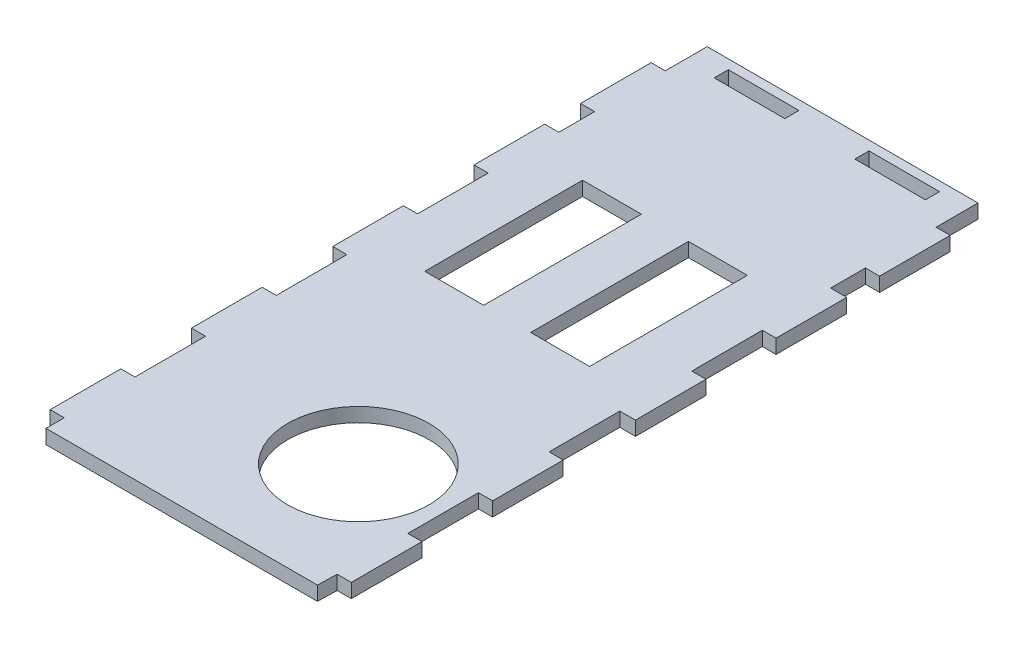
from build123d import *

# Parameters (mm, degrees)
SKETCH_1_R      = 30
SKETCH_1_W      = 25
SKETCH_1_H      = 67
EXTRUDE_1_DEPTH = 6


with BuildPart() as part:
    # Эскиз1 → Бобышка-Вытянуть1 (new body)
    with BuildSketch(Plane(origin=(0, 0, 0), x_dir=(1, 0, 0), z_dir=(0, 1, 0))):
        Polygon((-63.5, -90.219106224), (-63.5, -120.219106224), (-57.5, -120.219106224), (-57.5, -127.987103964), (-44.534331601, -127.987103964), (-14.534331601, -127.987103964), (15.172762814, -127.987103964), (45.172762814, -127.987103964), (57.756160079, -127.987103964), (57.965668399, -119.808299483), (63.965668399, -119.808299483), (63.965668399, -89.808299483), (57.965668399, -89.808299483), (57.965668399, -59.808299483), (63.965668399, -59.808299483), (63.965668399, -29.808299483), (57.965668399, -29.808299483), (57.965668399, 0.191700517), (64.611703668, 0.204499173), (64.557084704, 30.204449452), (58.557094649, 30.193525659), (58.502475685, 60.193475939), (64.331284091, 60.191395834), (64.331888746, 90.191395828), (57.5, 90.191533526), (57.5, 104.982806986), (63.5, 104.982806986), (63.5, 134.982806986), (57.5, 134.982806986), (57.5, 152.780893776), (-14.534331601, 152.780893776), (-57.5, 152.780893776), (-57.5, 134.982806986), (-63.5, 134.982806986), (-63.5, 104.982806986), (-57.5, 104.982806986), (-57.5, 89.780893776), (-63.5, 89.780893776), (-63.5, 59.780893776), (-63.034331601, 59.780893776), (-57.5, 59.780893776), (-57.5, 42.012896036), (-57.5, 29.780893776), (-63.5, 29.780893776), (-63.5, -0.219106224), (-63.034331601, -0.219106224), (-57.5, -0.219106224), (-57.5, -17.987103964), (-57.5, -30.219106224), (-63.5, -30.219106224), (-63.5, -60.219106224), (-63.034331601, -60.219106224), (-57.5, -60.219106224), (-57.5, -77.987103964), (-57.5, -90.219106224), align=None)
        with Locations(Location((21.965668399, -74.808299483, 0), (0, 0, 270))):
            Circle(SKETCH_1_R, mode=Mode.SUBTRACT)
        with Locations((-22.350212696, 43.691700517)):
            Rectangle(SKETCH_1_W, SKETCH_1_H, mode=Mode.SUBTRACT)
        Polygon((-14.534331601, 142.780893776), (-44.534331601, 142.780893776), (-44.534331601, 146.780893776), (-44.534331601, 148.780893776), (-14.534331601, 148.780893776), (-14.534331601, 146.780893776), align=None, mode=Mode.SUBTRACT)
        with Locations((22.649787304, 43.691700517)):
            Rectangle(SKETCH_1_W, SKETCH_1_H, mode=Mode.SUBTRACT)
        Polygon((45.172762814, 142.780893776), (15.172762814, 142.780893776), (15.172762814, 146.780893776), (15.172762814, 148.780893776), (45.172762814, 148.780893776), (45.172762814, 146.780893776), align=None, mode=Mode.SUBTRACT)
    extrude(amount=EXTRUDE_1_DEPTH)


solid = part.part
